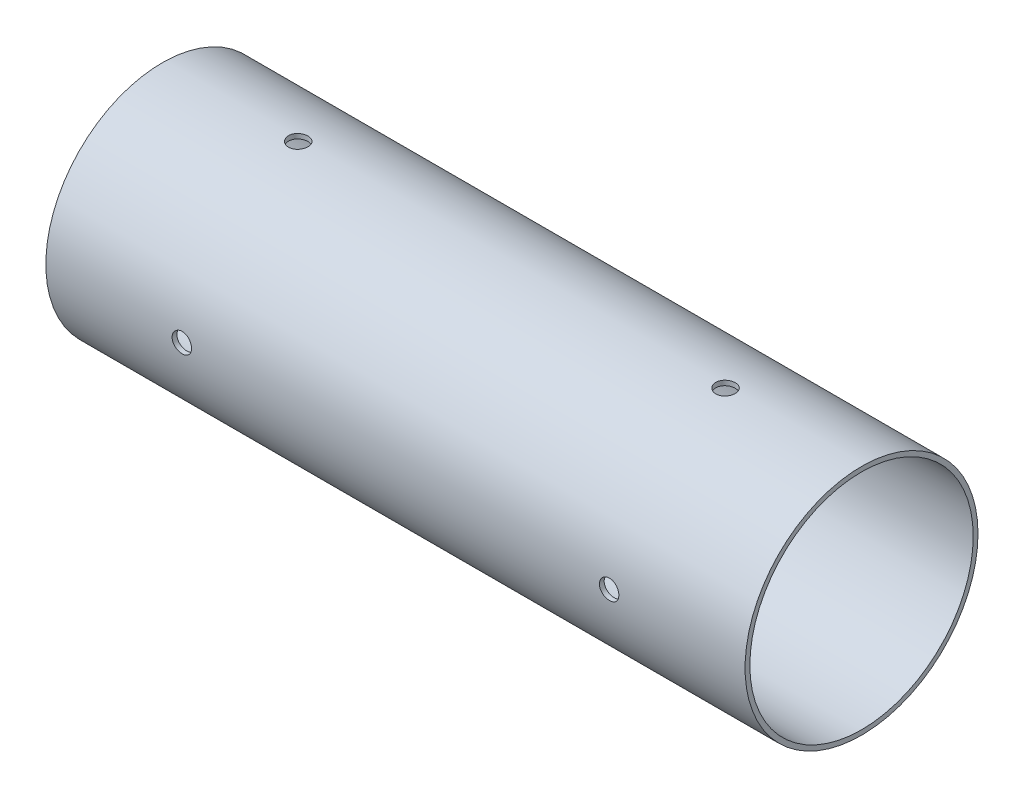
from build123d import *

# Parameters (mm, degrees)
SKETCH1_R           = 38.0746
SKETCH1_R_2         = 36.5125
BOSS_EXTRUDE1_DEPTH = 228.6
SKETCH2_R           = 3.175
CUT_EXTRUDE1_DEPTH  = 235.855935267
CIRPATTERN1_COUNT   = 4
SKETCH3_R           = 3.175
CUT_EXTRUDE2_DEPTH  = 235.855935397
CIRPATTERN2_COUNT   = 4


with BuildPart() as part:
    # Sketch1 → Boss-Extrude1 (new body)
    with BuildSketch(Plane.YZ):
        with Locations(Location((0, 0, 0), (0, 0, 270))):
            Circle(SKETCH1_R)
        with Locations(Location((0, 0, 0), (0, 0, 270))):
            Circle(SKETCH1_R_2, mode=Mode.SUBTRACT)
    extrude(amount=BOSS_EXTRUDE1_DEPTH)

    # Sketch2 → Cut-Extrude1 (cut, through all)
    with BuildSketch(Plane(origin=(0, 0, 0), x_dir=(-1, 0, 0), z_dir=(0, 1, 0))):
        with Locations(Location((-184.15, 0, 0), (0, 0, 90))):
            Circle(SKETCH2_R)
    cut_extrude1 = extrude(amount=-CUT_EXTRUDE1_DEPTH, mode=Mode.SUBTRACT)

    # CirPattern1: Cut-Extrude1 ×4 about axis
    cirpattern1_axis = Axis((228.6, 0, 0), (-1, 0, 0))
    for i in range(1, CIRPATTERN1_COUNT):
        add(cut_extrude1.rotate(cirpattern1_axis, i * 360 / CIRPATTERN1_COUNT), mode=Mode.SUBTRACT)

    # Sketch3 → Cut-Extrude2 (cut, through all)
    with BuildSketch(Plane(origin=(0, 0, 0), x_dir=(-1, 0, 0), z_dir=(0, 1, 0))):
        with Locations(Location((-44.45, 0, 0), (0, 0, 90))):
            Circle(SKETCH3_R)
    cut_extrude2 = extrude(amount=-CUT_EXTRUDE2_DEPTH, mode=Mode.SUBTRACT)

    # CirPattern2: Cut-Extrude2 ×4 about axis
    cirpattern2_axis = Axis((228.6, 0, 0), (-1, 0, 0))
    for i in range(1, CIRPATTERN2_COUNT):
        add(cut_extrude2.rotate(cirpattern2_axis, i * 360 / CIRPATTERN2_COUNT), mode=Mode.SUBTRACT)


solid = part.part
